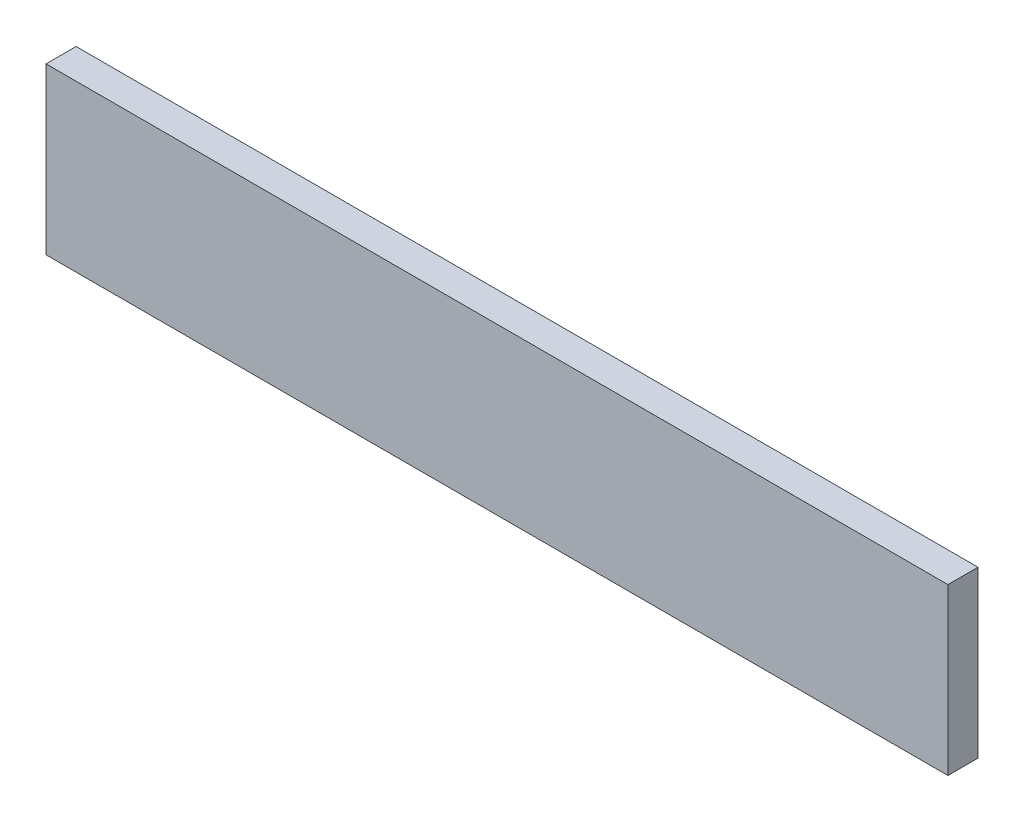
from build123d import *

# Parameters (mm, degrees)
SKETCH1_W           = 190.5
SKETCH1_H           = 34.925
BOSS_EXTRUDE1_DEPTH = 3.175


with BuildPart() as part:
    # Sketch1 → Boss-Extrude1 (new, symmetric)
    with BuildSketch(Plane.XY):
        Rectangle(SKETCH1_W, SKETCH1_H)
    extrude(amount=BOSS_EXTRUDE1_DEPTH, both=True)


solid = part.part
